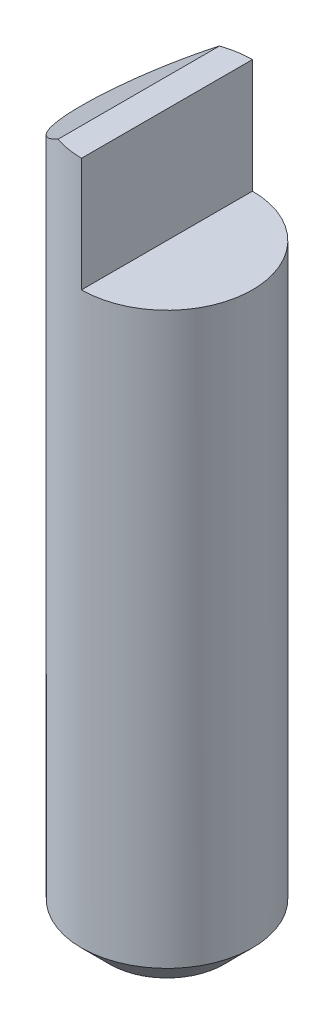
from build123d import *

# Parameters (mm, degrees)
SKETCH_1_R               = 3
EXTRUDE_1_DEPTH          = 25
CHAMFER_1_SIZE           = 1
CUT_EXTRUDE_1_DEPTH      = 26.357444666
CUT_EXTRUDE_1_DEPTH_BACK = 26.357444666
CUT_EXTRUDE_2_DEPTH      = 26.357444666
CUT_EXTRUDE_2_DEPTH_BACK = 26.357444666


with BuildPart() as part:
    # 草图1 → 凸台-拉伸1 (new body)
    with BuildSketch(Plane(origin=(0, 0, 0), x_dir=(1, 0, 0), z_dir=(0, 1, 0))):
        with Locations(Location((0, 0, 0), (0, 0, 270))):
            Circle(SKETCH_1_R)
    extrude(amount=EXTRUDE_1_DEPTH)

    # 倒角1
    chamfer_1_edges = [part.edges().sort_by_distance(p)[0] for p in [
        (0, 0, -3),
    ]]
    chamfer(chamfer_1_edges, length=CHAMFER_1_SIZE)

    # 草图2 → 切除-拉伸1 (cut, two sides: drawn at the far end of the back side and taken through both)
    with BuildSketch(Plane.XY.offset(-CUT_EXTRUDE_1_DEPTH_BACK)):
        Polygon((-52.748448143, -11.06198798), (-3, 23.6), (-0.990656871, 25), (48.757791272, 59.66198798), (-20.566184689, 159.158884265), (-122.072424103, 88.434908305), align=None)
    extrude(amount=CUT_EXTRUDE_1_DEPTH + CUT_EXTRUDE_1_DEPTH_BACK, mode=Mode.SUBTRACT)

    # 草图3 → 切除-拉伸2 (cut, two sides: drawn at the far end of the back side and taken through both)
    with BuildSketch(Plane.XY.offset(-CUT_EXTRUDE_2_DEPTH_BACK)):
        Polygon((0, 85.358713248), (0, 25), (0, 21), (3, 21), (63.358713248, 21), (149.384538564, 105.689163643), (86.025825316, 170.047876891), align=None)
    extrude(amount=CUT_EXTRUDE_2_DEPTH + CUT_EXTRUDE_2_DEPTH_BACK, mode=Mode.SUBTRACT)


solid = part.part
